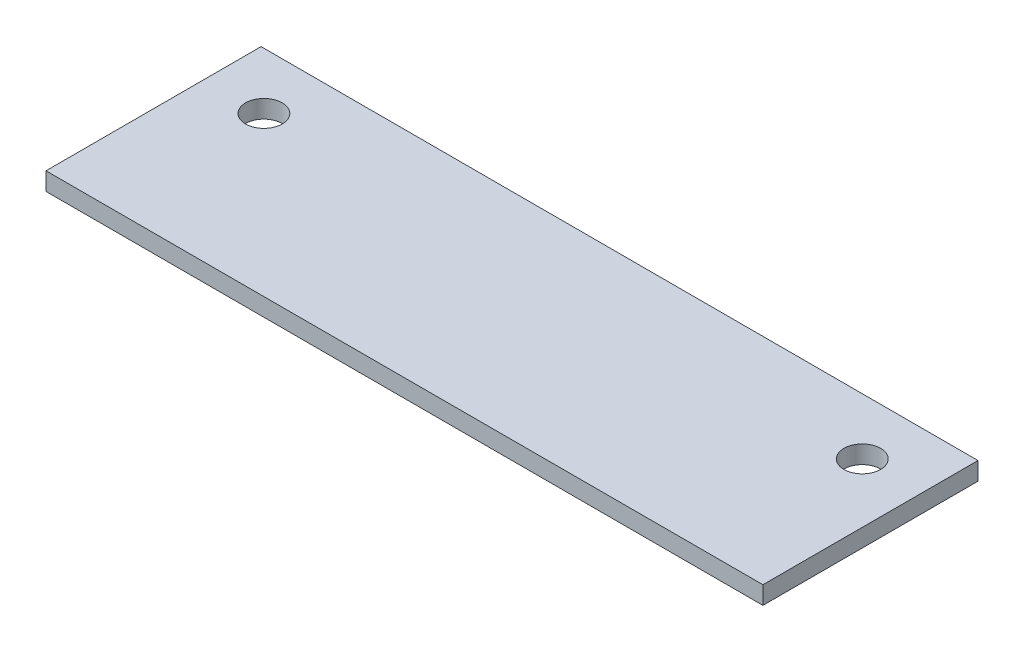
from build123d import *

# Parameters (mm, degrees)
SKETCH1_W           = 127
SKETCH1_H           = 76.2
BOSS_EXTRUDE1_DEPTH = 3.175
SKETCH3_W           = 127
SKETCH3_H           = 38.1
SKETCH3_R           = 3.25
CUT_EXTRUDE1_DEPTH  = 75.121121315


with BuildPart() as part:
    # Sketch1 → Boss-Extrude1 (new body)
    with BuildSketch(Plane(origin=(0, 0, 0), x_dir=(1, 0, 0), z_dir=(0, 1, 0))):
        Rectangle(SKETCH1_W, SKETCH1_H)
    extrude(amount=BOSS_EXTRUDE1_DEPTH)

    # Sketch3 → Cut-Extrude1 (cut, through all)
    with BuildSketch(Plane(origin=(0, 3.175, 0), x_dir=(1, 0, 0), z_dir=(0, 1, 0))):
        with Locations((0, -19.05)):
            Rectangle(SKETCH3_W, SKETCH3_H)
        with Locations(Location((-53, 28.1, 0), (0, 0, 270))):
            Circle(SKETCH3_R)
        with Locations(Location((53, 28.1, 0), (0, 0, 270))):
            Circle(SKETCH3_R)
    extrude(amount=-CUT_EXTRUDE1_DEPTH, mode=Mode.SUBTRACT)


solid = part.part
